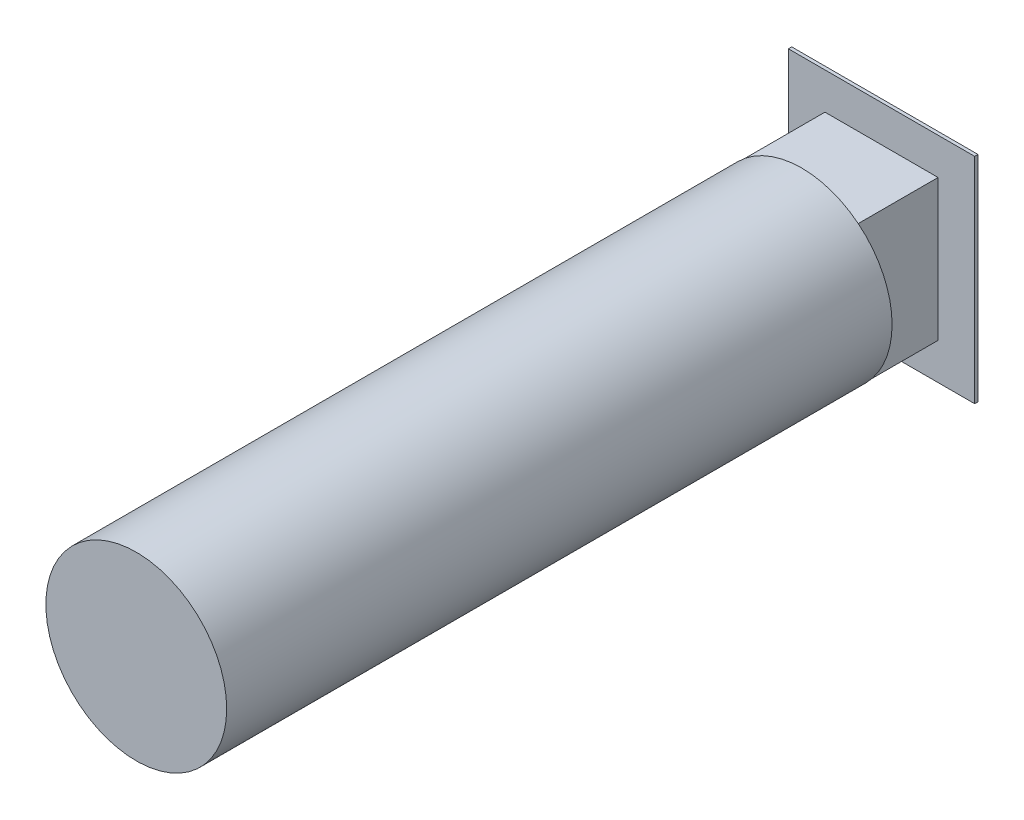
from build123d import *

# Parameters (mm, degrees)
CROQUIS1_W              = 140
CROQUIS1_H              = 161
CROQUIS1_W_2            = 80
CROQUIS1_H_2            = 101
SALIENTE_EXTRUIR1_DEPTH = 2.5
CROQUIS2_W              = 85
CROQUIS2_H              = 106
CROQUIS2_W_2            = 80
CROQUIS2_H_2            = 101
SALIENTE_EXTRUIR2_DEPTH = 60
CROQUIS3_R              = 67.935631299
SALIENTE_EXTRUIR3_DEPTH = 500


with BuildPart() as part:
    # Croquis1 → Saliente-Extruir1 (new body)
    with BuildSketch(Plane.XY):
        with Locations((70, -80.5)):
            Rectangle(CROQUIS1_W, CROQUIS1_H)
        with Locations((70, -80.5)):
            Rectangle(CROQUIS1_W_2, CROQUIS1_H_2, mode=Mode.SUBTRACT)
    extrude(amount=SALIENTE_EXTRUIR1_DEPTH)

    # Croquis2 → Saliente-Extruir2 (add)
    with BuildSketch(Plane.XY.offset(2.5)):
        with Locations((70, -80.5)):
            Rectangle(CROQUIS2_W, CROQUIS2_H)
        with Locations((70, -80.5)):
            Rectangle(CROQUIS2_W_2, CROQUIS2_H_2, mode=Mode.SUBTRACT)
    extrude(amount=SALIENTE_EXTRUIR2_DEPTH)

    # Croquis3 → Saliente-Extruir3 (add)
    with BuildSketch(Plane.XY.offset(62.5)):
        with Locations(Location((70, -80.5, 0), (0, 0, 128.725665443))):
            Circle(CROQUIS3_R)
    extrude(amount=SALIENTE_EXTRUIR3_DEPTH)


solid = part.part
